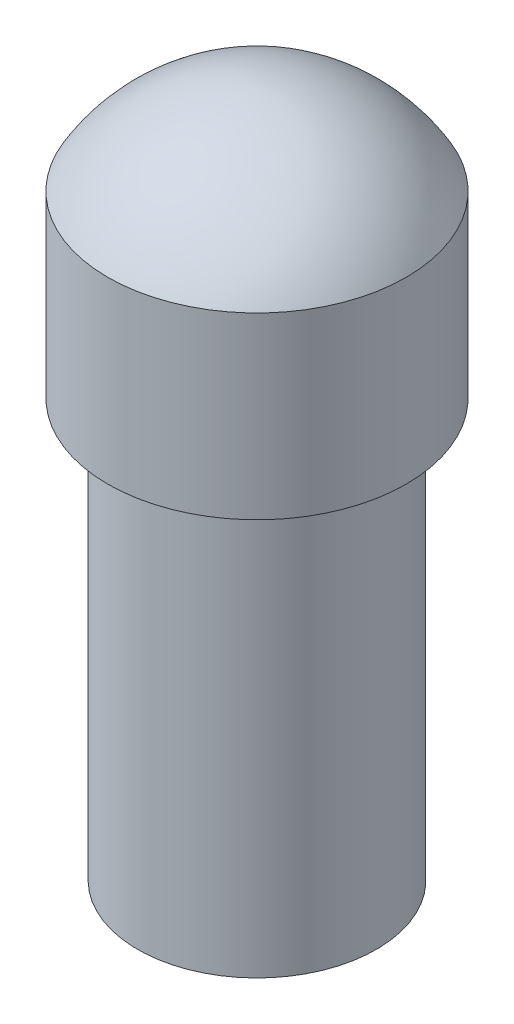
from build123d import *


with BuildPart() as part:
    # Sketch1 → Revolve1 (revolve)
    with BuildSketch(Plane.XY, mode=Mode.PRIVATE) as revolve1_sk:
        with BuildLine():
            Line((0, 0), (0, 23))
            ThreePointArc((0, 23), (2.888936029, 22.148226716), (5, 20))
            Line((5, 20), (5, 14))
            Line((5, 14), (4, 14))
            Line((4, 14), (4, 0))
            Line((4, 0), (0, 0))
        make_face()
    revolve(revolve1_sk.sketch.rotate(Axis((0, 0, 0), (0, 1, 0)), 90), axis=Axis((0, 0, 0), (0, 1, 0)))


solid = part.part
